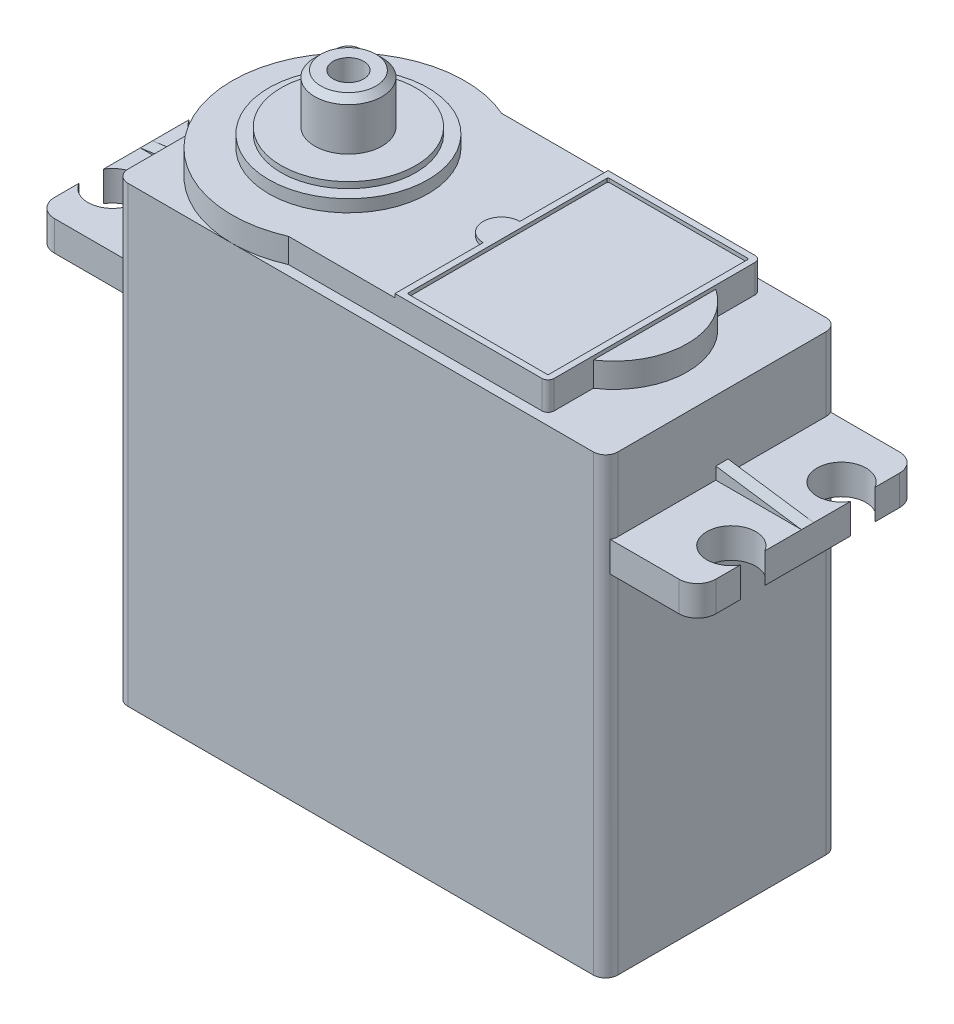
from build123d import *

# Parameters (mm, degrees)
SALIENTE_EXTRUIR1_DEPTH = 37
SALIENTE_EXTRUIR2_DEPTH = 2
CROQUIS3_R              = 6.5
SALIENTE_EXTRUIR3_DEPTH = 1
CROQUIS4_R              = 5.5
SALIENTE_EXTRUIR4_DEPTH = 0.5
CROQUIS5_R              = 2.75
SALIENTE_EXTRUIR5_DEPTH = 4
CROQUIS7_W              = 11.5
CROQUIS7_H              = 16.4
SALIENTE_EXTRUIR6_DEPTH = 0.3
REDONDEO1_R             = 0.1
REDONDEO2_R             = 0.5
SALIENTE_EXTRUIR7_START = -8.45
SALIENTE_EXTRUIR7_DEPTH = 2.45
SALIENTE_EXTRUIR8_DEPTH = 0.5
CROQUIS11_W             = 6
CROQUIS11_H             = 2.5
SALIENTE_EXTRUIR9_DEPTH = 5
SALIENTE_EXTRUIR9_DRAFT = -8
CROQUIS12_R             = 1.25
CORTAR_EXTRUIR1_DEPTH   = 5
CHAFL_N1_SIZE           = 0.5


with BuildPart() as part:
    # Croquis1 → Saliente-Extruir1 (new body)
    with BuildSketch(Plane(origin=(0, 0, 0), x_dir=(1, 0, 0), z_dir=(0, 1, 0))):
        with BuildLine():
            Line((1, 0), (39, 0))
            ThreePointArc((39, 0), (39.707106781, 0.292893219), (40, 1))
            Line((40, 1), (40, 18))
            ThreePointArc((40, 18), (39.707106781, 18.707106781), (39, 19))
            Line((39, 19), (1, 19))
            ThreePointArc((1, 19), (0.292893219, 18.707106781), (0, 18))
            Line((0, 18), (0, 1))
            ThreePointArc((0, 1), (0.292893219, 0.292893219), (1, 0))
        make_face()
    extrude(amount=SALIENTE_EXTRUIR1_DEPTH)

    # Croquis2 → Saliente-Extruir2 (add)
    with BuildSketch(Plane(origin=(0, 37, 0), x_dir=(1, 0, 0), z_dir=(0, 1, 0))):
        with BuildLine():
            Line((13.315756806, 18.2), (34.5, 18.2))
            Line((34.5, 18.2), (34.5, 14.5))
            ThreePointArc((34.5, 14.5), (37.18337521, 9.5), (34.5, 4.5))
            Line((34.5, 4.5), (34.5, 0.8))
            Line((34.5, 0.8), (13.315756806, 0.8))
            ThreePointArc((13.315756806, 0.8), (0, 9.5), (13.315756806, 18.2))
        make_face()
    extrude(amount=SALIENTE_EXTRUIR2_DEPTH)

    # Croquis3 → Saliente-Extruir3 (add)
    with BuildSketch(Plane(origin=(0, 39, 0), x_dir=(1, 0, 0), z_dir=(0, 1, 0))):
        with Locations(Location((9.5, 9.5, 0), (0, 0, 270))):
            Circle(CROQUIS3_R)
    extrude(amount=SALIENTE_EXTRUIR3_DEPTH)

    # Croquis4 → Saliente-Extruir4 (add)
    with BuildSketch(Plane(origin=(0, 40, 0), x_dir=(1, 0, 0), z_dir=(0, 1, 0))):
        with Locations(Location((9.5, 9.5, 0), (0, 0, 270))):
            Circle(CROQUIS4_R)
    extrude(amount=SALIENTE_EXTRUIR4_DEPTH)

    # Croquis5 → Saliente-Extruir5 (add)
    with BuildSketch(Plane(origin=(0, 40.5, 0), x_dir=(1, 0, 0), z_dir=(0, 1, 0))):
        with Locations(Location((9.5, 9.5, 0), (0, 0, 270))):
            Circle(CROQUIS5_R)
    extrude(amount=SALIENTE_EXTRUIR5_DEPTH)

    # Croquis7 → Saliente-Extruir6 (add)
    with BuildSketch(Plane(origin=(0, 39, 0), x_dir=(1, 0, 0), z_dir=(0, 1, 0))):
        with BuildLine():
            Line((34.5, 0.8), (22, 0.8))
            Line((22, 0.8), (22, 8))
            ThreePointArc((22, 8), (20.5, 9.5), (22, 11))
            Line((22, 11), (22, 18.2))
            Line((22, 18.2), (34.5, 18.2))
            Line((34.5, 18.2), (34.5, 0.8))
        make_face()
        with Locations((28.25, 9.5)):
            Rectangle(CROQUIS7_W, CROQUIS7_H, mode=Mode.SUBTRACT)
    extrude(amount=SALIENTE_EXTRUIR6_DEPTH)

    # Redondeo1
    redondeo1_edges = [part.edges().sort_by_distance(p)[0] for p in [
        (34, 39.15, -1.3),
        (34, 39.15, -17.7),
        (22.5, 39.15, -17.7),
        (22.5, 39.15, -1.3),
    ]]
    fillet(redondeo1_edges, radius=REDONDEO1_R)

    # Redondeo2
    redondeo2_edges = [part.edges().sort_by_distance(p)[0] for p in [
        (34.5, 38.15, -0.8),
        (34.5, 38.15, -18.2),
    ]]
    fillet(redondeo2_edges, radius=REDONDEO2_R)

    # Croquis8 → Saliente-Extruir7 (add)
    with BuildSketch(Plane(origin=(0, 37, 0), x_dir=(1, 0, 0), z_dir=(0, 1, 0)).offset(SALIENTE_EXTRUIR7_START)):
        with BuildLine():
            Line((40, 1), (40, 18))
            ThreePointArc((40, 18), (39.965925826, 18.258819045), (39.866025404, 18.5))
            Line((39.866025404, 18.5), (45.5, 18.5))
            ThreePointArc((45.5, 18.5), (46.560660172, 18.060660172), (47, 17))
            Line((47, 17), (47, 15))
            ThreePointArc((47, 15), (43.267949192, 14), (47, 13))
            Line((47, 13), (47, 6))
            ThreePointArc((47, 6), (43.267949192, 5), (47, 4))
            Line((47, 4), (47, 2))
            ThreePointArc((47, 2), (46.560660172, 0.939339828), (45.5, 0.5))
            Line((45.5, 0.5), (39.866025404, 0.5))
            ThreePointArc((39.866025404, 0.5), (39.965925826, 0.741180955), (40, 1))
        make_face()
        with BuildLine():
            Line((-7, 17), (-7, 15))
            ThreePointArc((-7, 15), (-3.267949192, 14), (-7, 13))
            Line((-7, 13), (-7, 6))
            ThreePointArc((-7, 6), (-3.267949192, 5), (-7, 4))
            Line((-7, 4), (-7, 2))
            ThreePointArc((-7, 2), (-6.560660172, 0.939339828), (-5.5, 0.5))
            Line((-5.5, 0.5), (0.133974596, 0.5))
            ThreePointArc((0.133974596, 0.5), (0.034074174, 0.741180955), (0, 1))
            Line((0, 1), (0, 18))
            ThreePointArc((0, 18), (0.034074174, 18.258819045), (0.133974596, 18.5))
            Line((0.133974596, 18.5), (-5.5, 18.5))
            ThreePointArc((-5.5, 18.5), (-6.560660172, 18.060660172), (-7, 17))
        make_face()
    extrude(amount=SALIENTE_EXTRUIR7_DEPTH)

    # Croquis10 → Saliente-Extruir8 (add, symmetric)
    with BuildSketch(Plane.XY.offset(-9.5)):
        Polygon((47, 31), (40, 32), (40, 31), align=None)
        Polygon((0, 32), (0, 31), (-7, 31), align=None)
    extrude(amount=SALIENTE_EXTRUIR8_DEPTH, both=True)


with BuildPart() as saliente_extruir9_tool:
    # Croquis11 → Saliente-Extruir9 (with draft: the straight prism first)
    with BuildSketch(Plane(origin=(0, 0, 0), x_dir=(0, 0, -1), z_dir=(1, 0, 0))):
        with Locations((9.5, 4.25)):
            Rectangle(CROQUIS11_W, CROQUIS11_H)
    extrude(amount=-SALIENTE_EXTRUIR9_DEPTH)
    # Saliente-Extruir9: the draft: its side faces are tilted about the plane it starts from
    saliente_extruir9_sides = [saliente_extruir9_tool.faces().sort_by_distance(p)[0] for p in [
        (-2.5, 4.25, -6.5),
        (-2.5, 3, -9.5),
        (-2.5, 4.25, -12.5),
        (-2.5, 5.5, -9.5),
    ]]
    draft(saliente_extruir9_sides, Plane(origin=(0, 0, 0), x_dir=(0, 0, -1), z_dir=(1, 0, 0)), SALIENTE_EXTRUIR9_DRAFT)


with BuildPart() as part_1:
    add(part.part)

    # Saliente-Extruir9: add saliente_extruir9_tool
    add(saliente_extruir9_tool.part)

    # Croquis12 → Cortar-Extruir1 (cut)
    with BuildSketch(Plane(origin=(0, 44.5, 0), x_dir=(1, 0, 0), z_dir=(0, 1, 0))):
        with Locations(Location((9.5, 9.5, 0), (0, 0, 270))):
            Circle(CROQUIS12_R)
    extrude(amount=-CORTAR_EXTRUIR1_DEPTH, mode=Mode.SUBTRACT)

    # Chaflán1
    chafl_n1_edges = [part_1.edges().sort_by_distance(p)[0] for p in [
        (9.5, 44.5, -12.25),
    ]]
    chamfer(chafl_n1_edges, length=CHAFL_N1_SIZE)


solid = part_1.part
